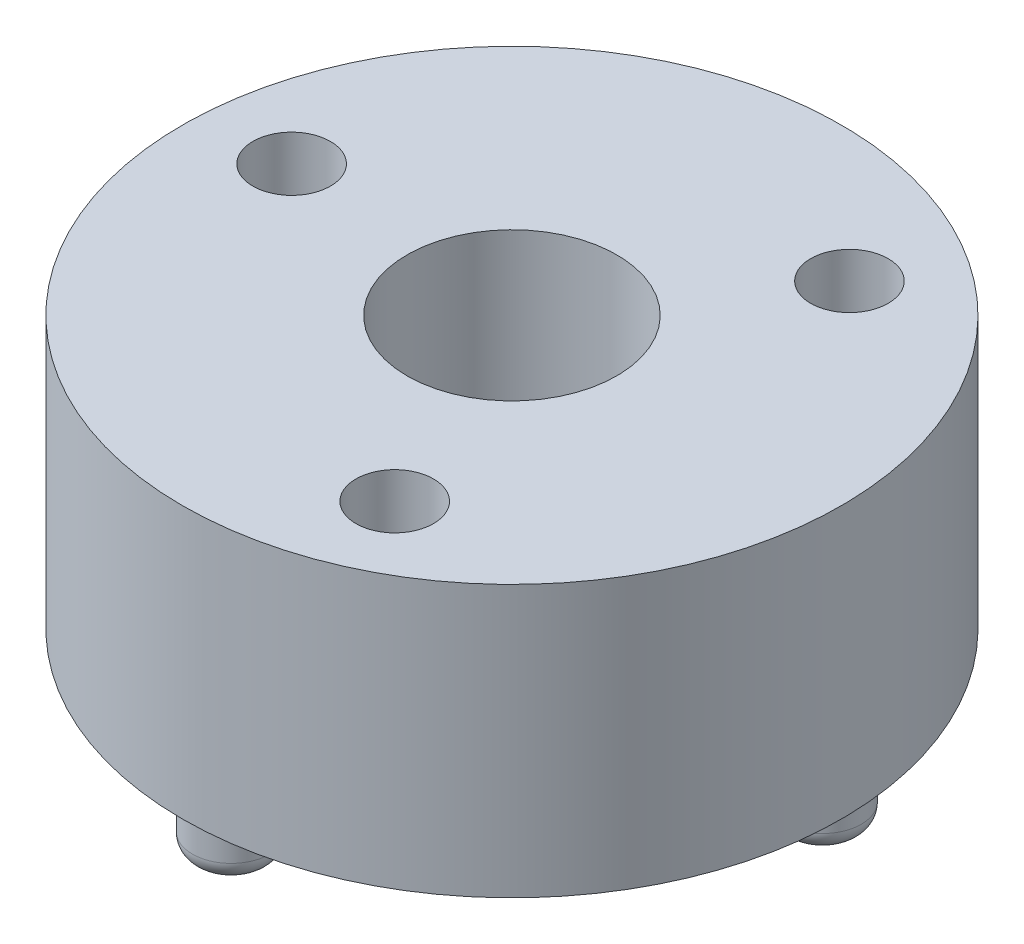
from build123d import *

# Parameters (mm, degrees)
SKETCH1_R           = 8.5
CYLINDER_DEPTH      = 7
SKETCH2_R           = 2.705
LUER_HOLE_DEPTH     = 5
SKETCH3_R           = 1
DOWEL_PINS_DEPTH    = 2.5
SKETCH4_R           = 1
SCREW_HOLES_DEPTH   = 14.910427743
FILLET_DOWEL_PINS_R = 0.5


with BuildPart() as part:
    # Sketch1 → Cylinder (new body)
    with BuildSketch(Plane(origin=(0, 0, 0), x_dir=(1, 0, 0), z_dir=(0, 1, 0))):
        with Locations(Location((0, 0, 0), (0, 0, 270))):
            Circle(SKETCH1_R)
    extrude(amount=CYLINDER_DEPTH)

    # Sketch2 → Luer Hole (cut)
    with BuildSketch(Plane(origin=(0, 7, 0), x_dir=(1, 0, 0), z_dir=(0, 1, 0))):
        with Locations(Location((0, 0, 0), (0, 0, 270))):
            Circle(SKETCH2_R)
    extrude(amount=-LUER_HOLE_DEPTH, mode=Mode.SUBTRACT)

    # Sketch3 → Dowel Pins (add)
    with BuildSketch(Plane.XZ):
        with Locations(Location((-1.08530111, 6.155048456, 0), (0, 0, 90))):
            Circle(SKETCH3_R)
        with Locations(Location((5.87307888, -2.137625896, 0), (0, 0, 90))):
            Circle(SKETCH3_R)
    extrude(amount=DOWEL_PINS_DEPTH)

    # Sketch4 → Screw Holes (cut, through all)
    with BuildSketch(Plane.XZ):
        with Locations(Location((-6.226216863, -0.544723392, 0), (0, 0, 270))):
            Circle(SKETCH4_R)
        with Locations(Location((2.641364136, 5.664423669, 0), (0, 0, 270))):
            Circle(SKETCH4_R)
        with Locations(Location((3.584852727, -5.119700277, 0), (0, 0, 270))):
            Circle(SKETCH4_R)
    extrude(amount=-SCREW_HOLES_DEPTH, mode=Mode.SUBTRACT)

    # Fillet Dowel Pins
    fillet_dowel_pins_edges = [part.edges().sort_by_distance(p)[0] for p in [
        (-1.08530111, -2.5, 5.155048456),
        (5.87307888, -2.5, -3.137625896),
    ]]
    fillet(fillet_dowel_pins_edges, radius=FILLET_DOWEL_PINS_R)


solid = part.part
